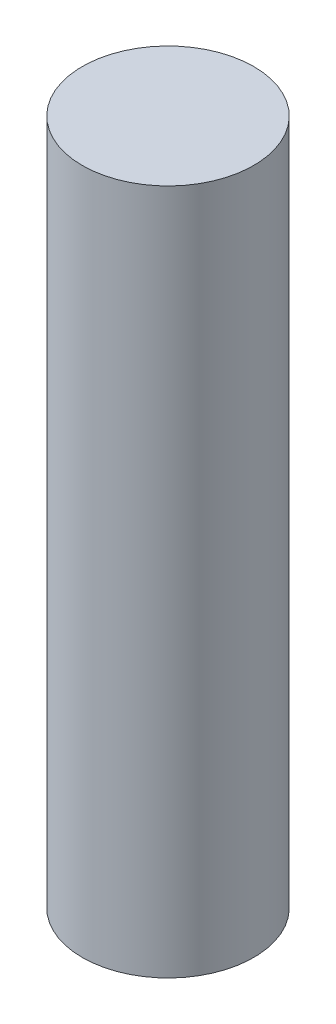
from build123d import *

# Parameters (mm, degrees)
SKETCH1_W = 6.35
SKETCH1_H = 50.8


with BuildPart() as part:
    # Sketch1 → Revolve1 (revolve)
    with BuildSketch(Plane.XY, mode=Mode.PRIVATE) as revolve1_sk:
        with Locations((3.175, 25.4)):
            Rectangle(SKETCH1_W, SKETCH1_H)
    revolve(revolve1_sk.sketch.rotate(Axis((0, 0, 0), (0, 1, 0)), 90), axis=Axis((0, 0, 0), (0, 1, 0)))


solid = part.part
